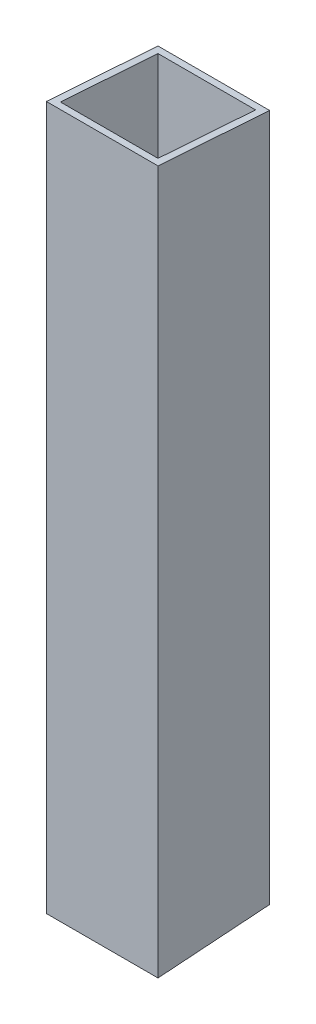
from build123d import *

# Parameters (mm, degrees)
SKETCH1_W               = 19.05
SKETCH1_H               = 19.05
BOSS_EXTRUDE1_DEPTH     = 120
SKETCH2_W               = 16.65
SKETCH2_H               = 16.65
CUT_EXTRUDE3_DEPTH      = 121.753680068
CUT_EXTRUDE4_DEPTH      = 121.753680068
CUT_EXTRUDE4_DEPTH_BACK = 121.753680068


with BuildPart() as part:
    # Sketch1 → Boss-Extrude1 (new body)
    with BuildSketch(Plane(origin=(0, 0, 0), x_dir=(1, 0, 0), z_dir=(0, 1, 0))):
        Rectangle(SKETCH1_W, SKETCH1_H)
    extrude(amount=BOSS_EXTRUDE1_DEPTH)

    # Sketch2 → Cut-Extrude3 (cut, through all)
    with BuildSketch(Plane(origin=(0, 0, 0), x_dir=(1, 0, 0), z_dir=(0, 1, 0))):
        Rectangle(SKETCH2_W, SKETCH2_H)
    extrude(amount=CUT_EXTRUDE3_DEPTH, mode=Mode.SUBTRACT)

    # Sketch3 → Cut-Extrude4 (cut, two sides: drawn at the far end of the back side and taken through both)
    with BuildSketch(Plane(origin=(0, 0, 0), x_dir=(0, 0, -1), z_dir=(1, 0, 0)).offset(-CUT_EXTRUDE4_DEPTH_BACK)):
        Polygon((-9.525, 120), (9.525, 118.667894232), (9.525, 120), align=None)
        Polygon((9.525, 0), (-9.525, 0), (9.525, 1.332105768), align=None)
    extrude(amount=CUT_EXTRUDE4_DEPTH + CUT_EXTRUDE4_DEPTH_BACK, mode=Mode.SUBTRACT)


solid = part.part
